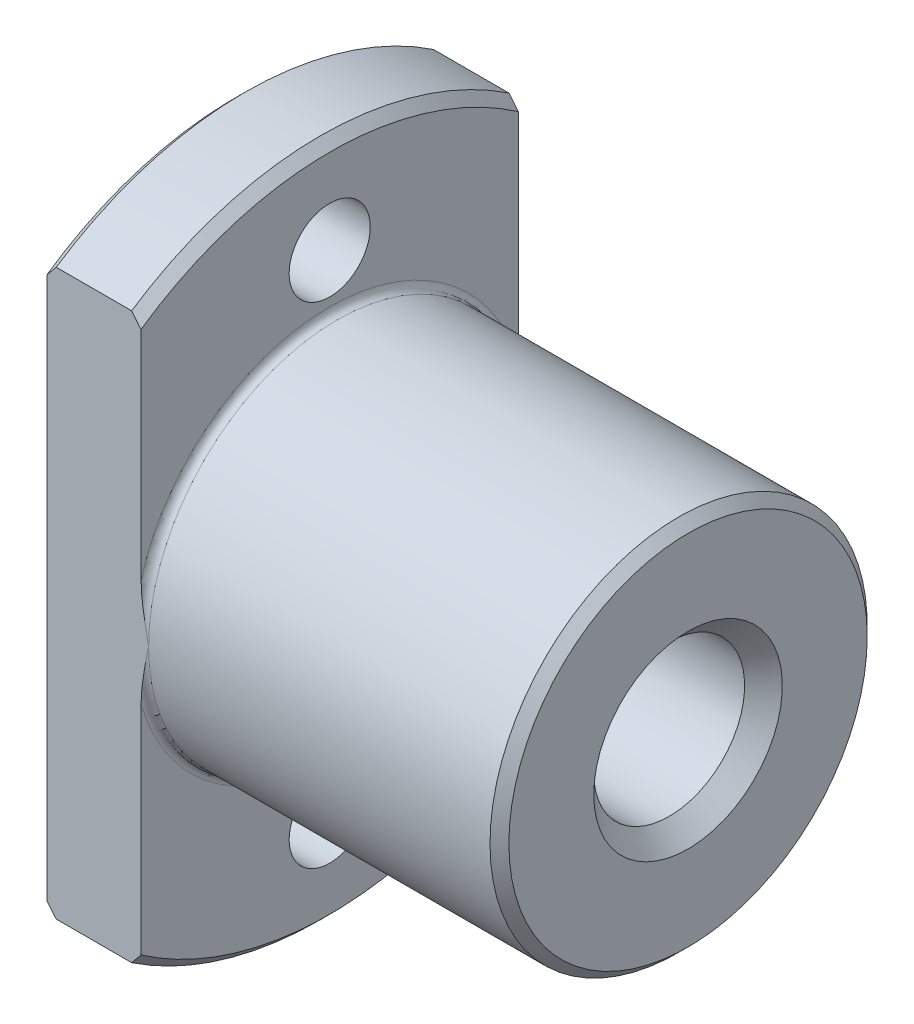
from build123d import *

# Parameters (mm, degrees)
SKETCH3_W               = 5
SKETCH3_H               = 2.15
SKETCH4_W               = 5
SKETCH4_H               = 2.15
CUT_EXTRUDE1_DEPTH      = 7.5
CUT_EXTRUDE1_DEPTH_BACK = 7.5
SKETCH5_W               = 40
SKETCH5_H               = 108
SKETCH5_W_2             = 20
SKETCH5_H_2             = 72


with BuildPart() as part:
    # Sketch1 → Revolve1 (revolve)
    with BuildSketch(Plane.XY, mode=Mode.PRIVATE) as revolve1_sk:
        with BuildLine():
            Line((0, 0), (0, 17.5))
            Line((0, 17.5), (0.5, 18))
            Line((0.5, 18), (4.5, 18))
            Line((4.5, 18), (5, 17.5))
            Line((5, 17.5), (5, 10.4))
            ThreePointArc((5, 10.4), (5.117157288, 10.117157288), (5.4, 10))
            Line((5.4, 10), (23.5, 10))
            Line((23.5, 10), (24, 9.5))
            Line((24, 9.5), (24, 0))
            Line((24, 0), (0, 0))
        make_face()
    revolve(revolve1_sk.sketch.rotate(Axis((24, 0, 0), (-1, 0, 0)), 270), axis=Axis((24, 0, 0), (-1, 0, 0)))

    # Sketch2 → Cut-Revolve1 (revolve, cut)
    with BuildSketch(Plane.XY, mode=Mode.PRIVATE) as cut_revolve1_sk:
        Polygon((0, 0), (0, 5), (1, 4), (23, 4), (24, 5), (24, 0), align=None)
    revolve(cut_revolve1_sk.sketch.rotate(Axis((24, 0, 0), (-1, 0, 0)), 270), axis=Axis((24, 0, 0), (-1, 0, 0)), mode=Mode.SUBTRACT)

    # Sketch3 → Cut-Revolve2 (revolve, cut)
    with BuildSketch(Plane.XY, mode=Mode.PRIVATE) as cut_revolve2_sk:
        with Locations((2.5, 14.075)):
            Rectangle(SKETCH3_W, SKETCH3_H)
    revolve(cut_revolve2_sk.sketch.rotate(Axis((5, 13, 0), (-1, 0, 0)), 270), axis=Axis((5, 13, 0), (-1, 0, 0)), mode=Mode.SUBTRACT)

    # Sketch4 → Cut-Revolve3 (revolve, cut)
    with BuildSketch(Plane.XY, mode=Mode.PRIVATE) as cut_revolve3_sk:
        with Locations((2.5, -11.925)):
            Rectangle(SKETCH4_W, SKETCH4_H)
    revolve(cut_revolve3_sk.sketch.rotate(Axis((5, -13, 0), (-1, 0, 0)), 270), axis=Axis((5, -13, 0), (-1, 0, 0)), mode=Mode.SUBTRACT)

    # Sketch5 → Cut-Extrude1 (cut, two sides: drawn at the far end of the back side and taken through both)
    with BuildSketch(Plane(origin=(0, 0, 0), x_dir=(0, 0, -1), z_dir=(1, 0, 0)).offset(-CUT_EXTRUDE1_DEPTH_BACK)):
        Rectangle(SKETCH5_W, SKETCH5_H)
        Rectangle(SKETCH5_W_2, SKETCH5_H_2, mode=Mode.SUBTRACT)
    extrude(amount=CUT_EXTRUDE1_DEPTH + CUT_EXTRUDE1_DEPTH_BACK, mode=Mode.SUBTRACT)


solid = part.part
